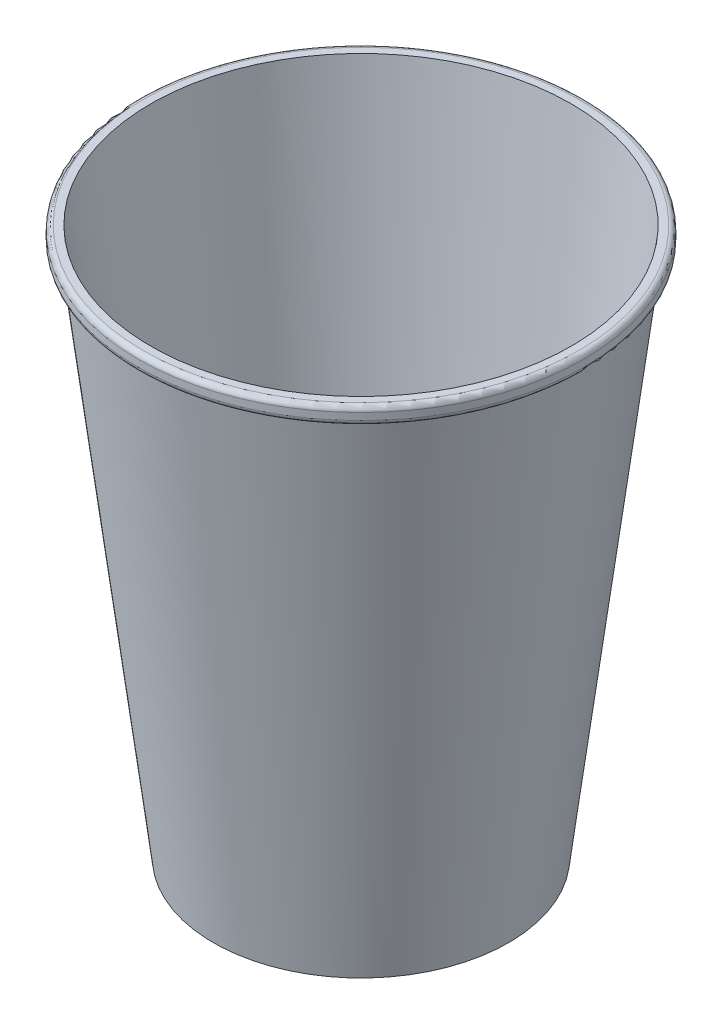
from build123d import *

# Parameters (mm, degrees)
REDONDEO1_R = 1


with BuildPart() as part:
    # Croquis1 → Revolución1 (revolve)
    with BuildSketch(Plane.XY, mode=Mode.PRIVATE) as revoluci_n1_sk:
        Polygon((29.507571263, 0), (42.588393181, 106.1), (44.5, 106.1), (44.5, 109.5), (42, 109.5), (29.424657534, 7.5), (0, 7.5), (0, 6.5), (29.301369863, 6.5), (28.5, 0), align=None)
    revolve(revoluci_n1_sk.sketch.rotate(Axis((0, 0, 0), (0, 1, 0)), 90), axis=Axis((0, 0, 0), (0, 1, 0)))

    # Redondeo1
    redondeo1_edges = [part.edges().sort_by_distance(p)[0] for p in [
        (0, 109.5, 44.5),
        (0, 106.1, 44.5),
    ]]
    fillet(redondeo1_edges, radius=REDONDEO1_R)


solid = part.part
